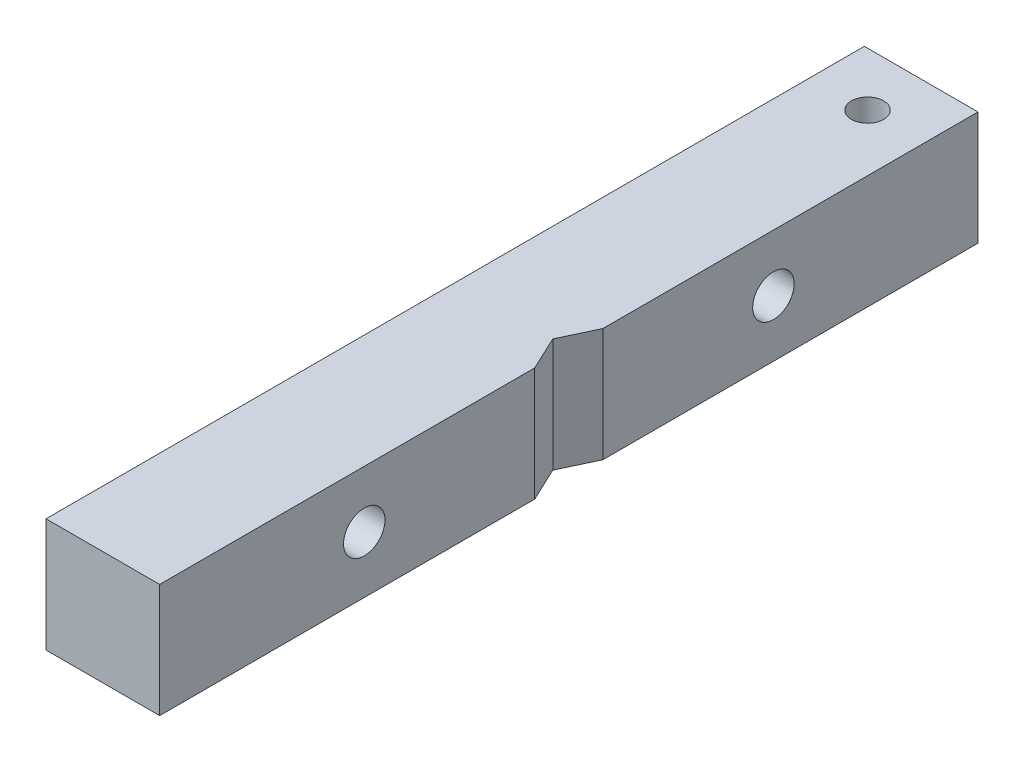
from build123d import *

# Parameters (mm, degrees)
SKETCH1_W                  = 15.875
SKETCH1_H                  = 15.875
BOSS_EXTRUDE1_DEPTH        = 57.15
CUT_EXTRUDE1_DEPTH         = 60.842643919
CUT_EXTRUDE1_DEPTH_BACK    = 60.842643919
F_12_CLEARANCE_HOLE1_D     = 5.7912
F_12_CLEARANCE_HOLE1_DEPTH = 42.07002
F_12_CLEARANCE_HOLE1_TIP   = 1.739852008
F_12_24_TAPPED_HOLE1_D     = 4.4958


with BuildPart() as part:
    # Sketch1 → Boss-Extrude1 (new, symmetric)
    with BuildSketch(Plane.XY):
        Rectangle(SKETCH1_W, SKETCH1_H)
    extrude(amount=BOSS_EXTRUDE1_DEPTH, both=True)

    # Sketch2 → Cut-Extrude1 (cut, two sides: drawn at the far end of the back side and taken through both)
    with BuildSketch(Plane(origin=(0, 7.9375, 0), x_dir=(1, 0, 0), z_dir=(0, 1, 0)).offset(-CUT_EXTRUDE1_DEPTH_BACK)):
        Polygon((66.547875099, 129.510772403), (7.9375, 4.7625), (5.699938661, 0), (7.9375, -4.7625), (66.547875099, -129.510772403), (342.209316267, -129.510772403), (342.209316267, 129.510772403), align=None)
    extrude(amount=CUT_EXTRUDE1_DEPTH + CUT_EXTRUDE1_DEPTH_BACK, mode=Mode.SUBTRACT)

    # #12 Clearance Hole1
    with Locations(Plane(origin=(7.9375, 0, 0), x_dir=(0, 0, -1), z_dir=(1, 0, 0))):
        with Locations((28.575, 0), (-28.575, 0)):
            Hole(F_12_CLEARANCE_HOLE1_D / 2, depth=F_12_CLEARANCE_HOLE1_DEPTH)
            with Locations((0, 0, -(F_12_CLEARANCE_HOLE1_DEPTH + F_12_CLEARANCE_HOLE1_TIP / 2))):  # 118° drill point
                Cone(0, F_12_CLEARANCE_HOLE1_D / 2, F_12_CLEARANCE_HOLE1_TIP, mode=Mode.SUBTRACT)

    # #12-24 Tapped Hole1 (through all)
    with Locations(Plane(origin=(0, -7.9375, 0), x_dir=(-1, 0, 0), z_dir=(0, -1, 0))):
        with Locations((0, 49.653581933)):
            Hole(F_12_24_TAPPED_HOLE1_D / 2)


solid = part.part
